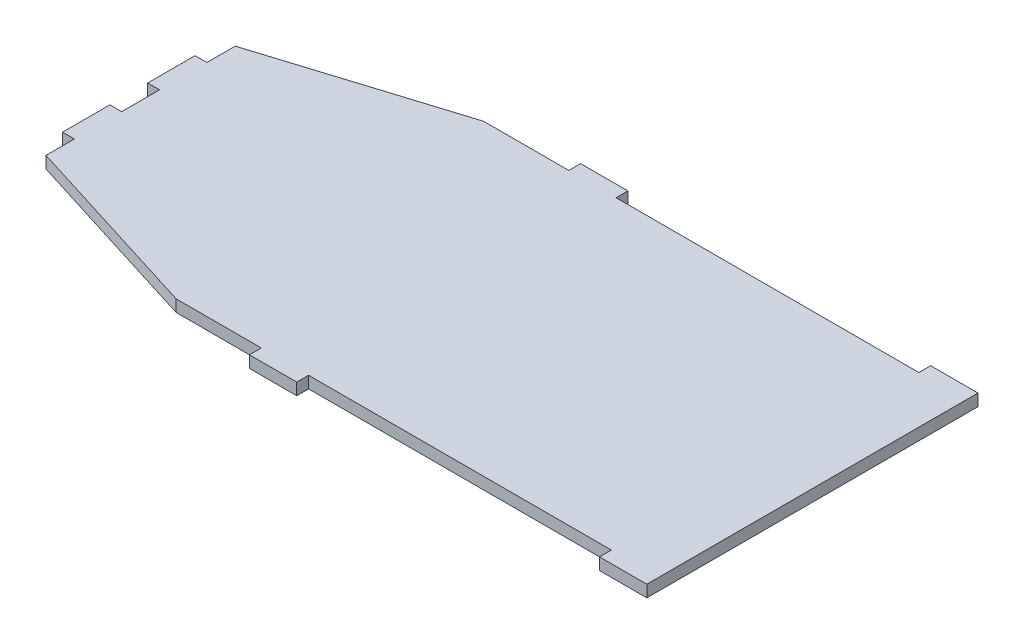
from build123d import *

# Parameters (mm, degrees)
BOSS_EXTRUDE1_DEPTH = 3.175


with BuildPart() as part:
    # Sketch1 → Boss-Extrude1 (new body)
    with BuildSketch(Plane(origin=(0, 0, 0), x_dir=(1, 0, 0), z_dir=(0, 1, 0))):
        Polygon((3.175, 0), (3.175, -5.08), (0, -5.08), (0, -17.78), (3.175, -17.78), (3.175, -25.4), (53.975, -41.275), (76.835, -41.275), (76.835, -44.45), (89.535, -44.45), (89.535, -41.275), (170.815, -41.275), (170.815, -44.45), (183.515, -44.45), (183.515, -41.275), (183.515, 41.275), (183.515, 44.45), (170.815, 44.45), (170.815, 41.275), (89.535, 41.275), (89.535, 44.45), (76.835, 44.45), (76.835, 41.275), (53.975, 41.275), (3.175, 25.4), (3.175, 17.78), (0, 17.78), (0, 5.08), (3.175, 5.08), align=None)
    extrude(amount=BOSS_EXTRUDE1_DEPTH)


solid = part.part
